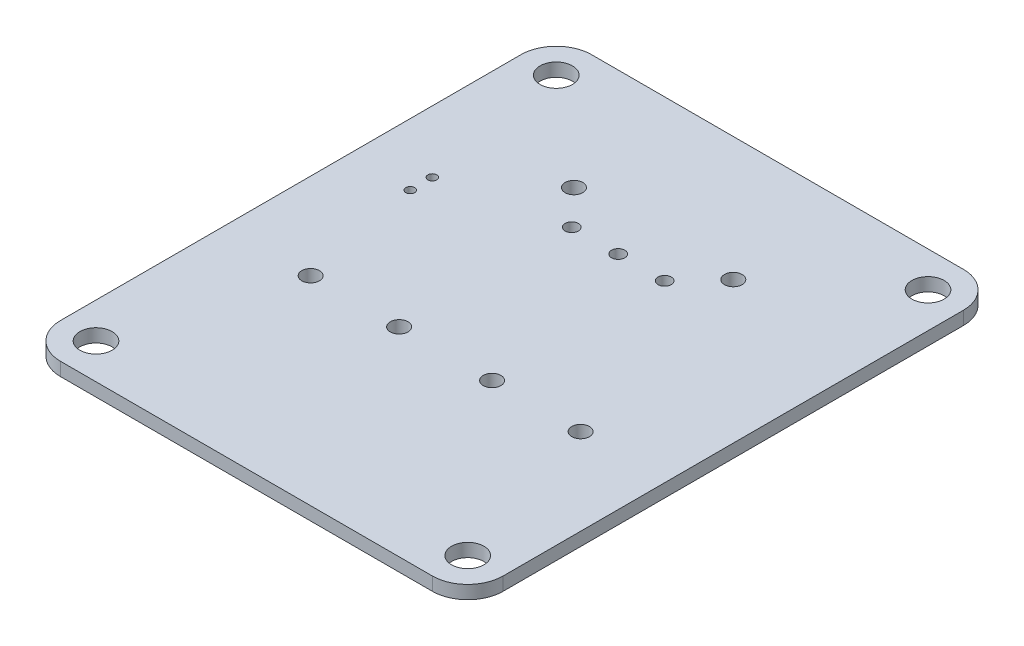
from build123d import *

# Parameters (mm, degrees)
SKETCH1_R           = 1.825
BOSS_EXTRUDE1_DEPTH = 1.5
CUT_EXTRUDE1_REACH  = 41.08
SKETCH2_R           = 1
SKETCH2_R_2         = 0.75
SKETCH2_R_3         = 0.5


with BuildPart() as part:
    # Sketch1 → Boss-Extrude1 (new body)
    with BuildSketch(Plane(origin=(0, 0, 0), x_dir=(1, 0, 0), z_dir=(0, 1, 0))):
        with BuildLine():
            Line((-21, 30), (21, 30))
            ThreePointArc((21, 30), (23.828427125, 28.828427125), (25, 26))
            Line((25, 26), (25, -26))
            ThreePointArc((25, -26), (23.828427125, -28.828427125), (21, -30))
            Line((21, -30), (-21, -30))
            ThreePointArc((-21, -30), (-23.828427125, -28.828427125), (-25, -26))
            Line((-25, -26), (-25, 26))
            ThreePointArc((-25, 26), (-23.828427125, 28.828427125), (-21, 30))
        make_face()
        with Locations(Location((-21, 26, 0), (0, 0, 270))):
            Circle(SKETCH1_R, mode=Mode.SUBTRACT)
        with Locations(Location((21, 26, 0), (0, 0, 90))):
            Circle(SKETCH1_R, mode=Mode.SUBTRACT)
        with Locations(Location((21, -26, 0), (0, 0, 270))):
            Circle(SKETCH1_R, mode=Mode.SUBTRACT)
        with Locations(Location((-21, -26, 0), (0, 0, 90))):
            Circle(SKETCH1_R, mode=Mode.SUBTRACT)
    extrude(amount=BOSS_EXTRUDE1_DEPTH)

    # Sketch2 → Cut-Extrude1 (cut, up to next)
    with BuildSketch(Plane(origin=(0, 1.5, 0), x_dir=(1, 0, 0), z_dir=(0, 1, 0)), mode=Mode.PRIVATE) as cut_extrude1_sk1:
        with Locations(Location((-9, 16, 0), (0, 0, 270))):
            Circle(SKETCH2_R)
    cut_extrude1_tool1 = extrude(cut_extrude1_sk1.sketch, amount=-CUT_EXTRUDE1_REACH, mode=Mode.PRIVATE) & part.part
    # Sketch2 → Cut-Extrude1 (cut, up to next)
    with BuildSketch(Plane(origin=(0, 1.5, 0), x_dir=(1, 0, 0), z_dir=(0, 1, 0)), mode=Mode.PRIVATE) as cut_extrude1_sk2:
        with Locations(Location((9, 16, 0), (0, 0, 270))):
            Circle(SKETCH2_R)
    cut_extrude1_tool2 = extrude(cut_extrude1_sk2.sketch, amount=-CUT_EXTRUDE1_REACH, mode=Mode.PRIVATE) & part.part
    # Sketch2 → Cut-Extrude1 (cut, up to next)
    with BuildSketch(Plane(origin=(0, 1.5, 0), x_dir=(1, 0, 0), z_dir=(0, 1, 0)), mode=Mode.PRIVATE) as cut_extrude1_sk3:
        with Locations(Location((-5.25, 12, 0), (0, 0, 270))):
            Circle(SKETCH2_R_2)
    cut_extrude1_tool3 = extrude(cut_extrude1_sk3.sketch, amount=-CUT_EXTRUDE1_REACH, mode=Mode.PRIVATE) & part.part
    # Sketch2 → Cut-Extrude1 (cut, up to next)
    with BuildSketch(Plane(origin=(0, 1.5, 0), x_dir=(1, 0, 0), z_dir=(0, 1, 0)), mode=Mode.PRIVATE) as cut_extrude1_sk4:
        with Locations(Location((0, 12, 0), (0, 0, 270))):
            Circle(SKETCH2_R_2)
    cut_extrude1_tool4 = extrude(cut_extrude1_sk4.sketch, amount=-CUT_EXTRUDE1_REACH, mode=Mode.PRIVATE) & part.part
    # Sketch2 → Cut-Extrude1 (cut, up to next)
    with BuildSketch(Plane(origin=(0, 1.5, 0), x_dir=(1, 0, 0), z_dir=(0, 1, 0)), mode=Mode.PRIVATE) as cut_extrude1_sk5:
        with Locations(Location((5.25, 12, 0), (0, 0, 270))):
            Circle(SKETCH2_R_2)
    cut_extrude1_tool5 = extrude(cut_extrude1_sk5.sketch, amount=-CUT_EXTRUDE1_REACH, mode=Mode.PRIVATE) & part.part
    # Sketch2 → Cut-Extrude1 (cut, up to next)
    with BuildSketch(Plane(origin=(0, 1.5, 0), x_dir=(1, 0, 0), z_dir=(0, 1, 0)), mode=Mode.PRIVATE) as cut_extrude1_sk6:
        with Locations(Location((-15.25, -7.5, 0), (0, 0, 270))):
            Circle(SKETCH2_R)
    cut_extrude1_tool6 = extrude(cut_extrude1_sk6.sketch, amount=-CUT_EXTRUDE1_REACH, mode=Mode.PRIVATE) & part.part
    # Sketch2 → Cut-Extrude1 (cut, up to next)
    with BuildSketch(Plane(origin=(0, 1.5, 0), x_dir=(1, 0, 0), z_dir=(0, 1, 0)), mode=Mode.PRIVATE) as cut_extrude1_sk7:
        with Locations(Location((-5.25, -7.5, 0), (0, 0, 270))):
            Circle(SKETCH2_R)
    cut_extrude1_tool7 = extrude(cut_extrude1_sk7.sketch, amount=-CUT_EXTRUDE1_REACH, mode=Mode.PRIVATE) & part.part
    # Sketch2 → Cut-Extrude1 (cut, up to next)
    with BuildSketch(Plane(origin=(0, 1.5, 0), x_dir=(1, 0, 0), z_dir=(0, 1, 0)), mode=Mode.PRIVATE) as cut_extrude1_sk8:
        with Locations(Location((5.25, -7.5, 0), (0, 0, 270))):
            Circle(SKETCH2_R)
    cut_extrude1_tool8 = extrude(cut_extrude1_sk8.sketch, amount=-CUT_EXTRUDE1_REACH, mode=Mode.PRIVATE) & part.part
    # Sketch2 → Cut-Extrude1 (cut, up to next)
    with BuildSketch(Plane(origin=(0, 1.5, 0), x_dir=(1, 0, 0), z_dir=(0, 1, 0)), mode=Mode.PRIVATE) as cut_extrude1_sk9:
        with Locations(Location((15.25, -7.5, 0), (0, 0, 270))):
            Circle(SKETCH2_R)
    cut_extrude1_tool9 = extrude(cut_extrude1_sk9.sketch, amount=-CUT_EXTRUDE1_REACH, mode=Mode.PRIVATE) & part.part
    # Sketch2 → Cut-Extrude1 (cut, up to next)
    with BuildSketch(Plane(origin=(0, 1.5, 0), x_dir=(1, 0, 0), z_dir=(0, 1, 0)), mode=Mode.PRIVATE) as cut_extrude1_sk10:
        with Locations(Location((-18, 9, 0), (0, 0, 270))):
            Circle(SKETCH2_R_3)
    cut_extrude1_tool10 = extrude(cut_extrude1_sk10.sketch, amount=-CUT_EXTRUDE1_REACH, mode=Mode.PRIVATE) & part.part
    # Sketch2 → Cut-Extrude1 (cut, up to next)
    with BuildSketch(Plane(origin=(0, 1.5, 0), x_dir=(1, 0, 0), z_dir=(0, 1, 0)), mode=Mode.PRIVATE) as cut_extrude1_sk11:
        with Locations(Location((-18, 6.5, 0), (0, 0, 270))):
            Circle(SKETCH2_R_3)
    cut_extrude1_tool11 = extrude(cut_extrude1_sk11.sketch, amount=-CUT_EXTRUDE1_REACH, mode=Mode.PRIVATE) & part.part
    add(cut_extrude1_tool1.solids().sort_by_distance((-9, 1.5, -16))[0], mode=Mode.SUBTRACT)
    add(cut_extrude1_tool2.solids().sort_by_distance((9, 1.5, -16))[0], mode=Mode.SUBTRACT)
    add(cut_extrude1_tool3.solids().sort_by_distance((-5.25, 1.5, -12))[0], mode=Mode.SUBTRACT)
    add(cut_extrude1_tool4.solids().sort_by_distance((0, 1.5, -12))[0], mode=Mode.SUBTRACT)
    add(cut_extrude1_tool5.solids().sort_by_distance((5.25, 1.5, -12))[0], mode=Mode.SUBTRACT)
    add(cut_extrude1_tool6.solids().sort_by_distance((-15.25, 1.5, 7.5))[0], mode=Mode.SUBTRACT)
    add(cut_extrude1_tool7.solids().sort_by_distance((-5.25, 1.5, 7.5))[0], mode=Mode.SUBTRACT)
    add(cut_extrude1_tool8.solids().sort_by_distance((5.25, 1.5, 7.5))[0], mode=Mode.SUBTRACT)
    add(cut_extrude1_tool9.solids().sort_by_distance((15.25, 1.5, 7.5))[0], mode=Mode.SUBTRACT)
    add(cut_extrude1_tool10.solids().sort_by_distance((-18, 1.5, -9))[0], mode=Mode.SUBTRACT)
    add(cut_extrude1_tool11.solids().sort_by_distance((-18, 1.5, -6.5))[0], mode=Mode.SUBTRACT)


solid = part.part
